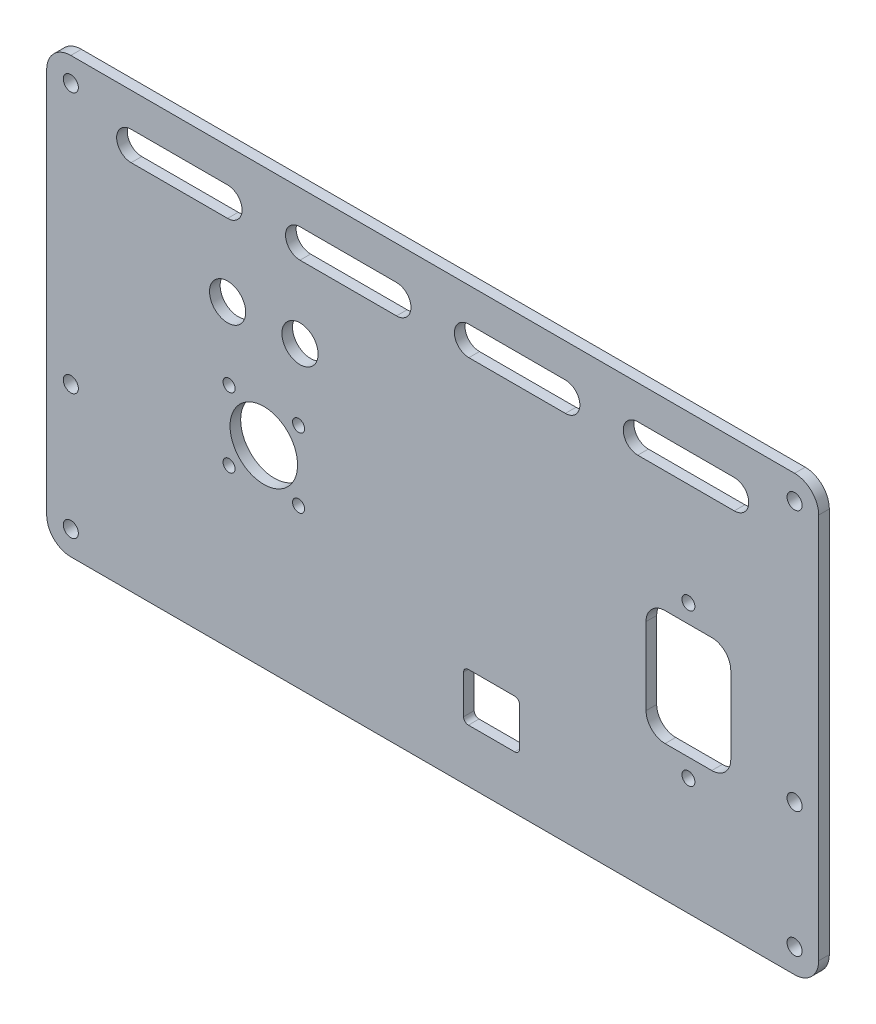
from build123d import *

# Parameters (mm, degrees)
SKETCH1_W                       = 203.2
SKETCH1_H                       = 114.3
BOSS_EXTRUDE1_DEPTH             = 2.794
F_5_32_0_15625_DIAMETER_HOLE1_D = 3.96875
FILLET2_R                       = 6.35
SKETCH7_R                       = 8.89
SKETCH7_R_2                     = 1.5875
SKETCH7_W                       = 14.732
SKETCH7_H                       = 12.7
CUT_EXTRUDE1_DEPTH              = 117.603983362
FILLET3_R                       = 1.27
F_3_8_0_375_DIAMETER_HOLE1_D    = 9.525
SKETCH12_R                      = 1.7
CUT_EXTRUDE4_DEPTH              = 117.603983362
CUT_EXTRUDE5_DEPTH              = 117.603983362


with BuildPart() as part:
    # Sketch1 → Boss-Extrude1 (new body)
    with BuildSketch(Plane.XY):
        Rectangle(SKETCH1_W, SKETCH1_H)
    extrude(amount=BOSS_EXTRUDE1_DEPTH)

    # 5/32 (0.15625) Diameter Hole1 (through all)
    with Locations(Plane.XY.offset(2.794)):
        with Locations((95.25, -17.78), (-95.25, 50.8), (95.25, 50.8), (95.25, -50.8), (-95.25, -50.8), (-95.25, -17.78)):
            Hole(F_5_32_0_15625_DIAMETER_HOLE1_D / 2)

    # Fillet2
    fillet2_edges = [part.edges().sort_by_distance(p)[0] for p in [
        (101.6, -57.15, 1.397),
        (-101.6, -57.15, 1.397),
        (-101.6, 57.15, 1.397),
        (101.6, 57.15, 1.397),
    ]]
    fillet(fillet2_edges, radius=FILLET2_R)

    # Sketch7 → Cut-Extrude1 (cut, through all)
    with BuildSketch(Plane(origin=(0, 0, 0), x_dir=(-1, 0, 0), z_dir=(0, 0, -1))):
        with Locations((44.45, -6.35)):
            Circle(SKETCH7_R)
        with Locations((53.6, 2.8)):
            Circle(SKETCH7_R_2)
        with Locations(Location((35.3, 2.8, 0), (0, 0, 180))):
            Circle(SKETCH7_R_2)
        with Locations(Location((53.6, -15.5, 0), (0, 0, 180))):
            Circle(SKETCH7_R_2)
        with Locations((35.3, -15.5)):
            Circle(SKETCH7_R_2)
        with Locations((-15.494, -36.83)):
            Rectangle(SKETCH7_W, SKETCH7_H)
    extrude(amount=-CUT_EXTRUDE1_DEPTH, mode=Mode.SUBTRACT)

    # Fillet3
    fillet3_edges = [part.edges().sort_by_distance(p)[0] for p in [
        (22.86, -43.18, 1.397),
        (22.86, -30.48, 1.397),
        (8.128, -30.48, 1.397),
        (8.128, -43.18, 1.397),
    ]]
    fillet(fillet3_edges, radius=FILLET3_R)

    # 3/8 (0.375) Diameter Hole1 (through all)
    with Locations(Plane(origin=(0, 0, 0), x_dir=(-1, 0, 0), z_dir=(0, 0, -1))):
        with Locations((53.975, 21.59), (34.925, 21.59)):
            Hole(F_3_8_0_375_DIAMETER_HOLE1_D / 2)

    # Sketch12 → Cut-Extrude4 (cut, through all)
    with BuildSketch(Plane(origin=(0, 0, 0), x_dir=(-1, 0, 0), z_dir=(0, 0, -1))):
        with Locations((-67.31, -26.35)):
            Circle(SKETCH12_R)
        with Locations(Location((-67.31, 13.65, 0), (0, 0, 180))):
            Circle(SKETCH12_R)
        with BuildLine():
            Line((-73.46, 8.8), (-61.16, 8.8))
            ThreePointArc((-61.16, 8.8), (-57.624466094, 7.335533906), (-56.16, 3.8))
            Line((-56.16, 3.8), (-56.16, -16.5))
            ThreePointArc((-56.16, -16.5), (-57.624466094, -20.035533906), (-61.16, -21.5))
            Line((-61.16, -21.5), (-73.46, -21.5))
            ThreePointArc((-73.46, -21.5), (-76.995533906, -20.035533906), (-78.46, -16.5))
            Line((-78.46, -16.5), (-78.46, 3.8))
            ThreePointArc((-78.46, 3.8), (-76.995533906, 7.335533906), (-73.46, 8.8))
        make_face()
    extrude(amount=-CUT_EXTRUDE4_DEPTH, mode=Mode.SUBTRACT)

    # Sketch13 → Cut-Extrude5 (cut, through all)
    with BuildSketch(Plane(origin=(0, 0, 0), x_dir=(-1, 0, 0), z_dir=(0, 0, -1))):
        with BuildLine():
            Line((-79.375, 48.26), (-53.975, 48.26))
            ThreePointArc((-53.975, 48.26), (-50.165, 44.45), (-53.975, 40.64))
            Line((-53.975, 40.64), (-79.375, 40.64))
            ThreePointArc((-79.375, 40.64), (-83.185, 44.45), (-79.375, 48.26))
        make_face()
        with BuildLine():
            Line((79.375, 48.26), (53.975, 48.26))
            ThreePointArc((53.975, 48.26), (50.165, 44.45), (53.975, 40.64))
            Line((53.975, 40.64), (79.375, 40.64))
            ThreePointArc((79.375, 40.64), (83.185, 44.45), (79.375, 48.26))
        make_face()
        with BuildLine():
            Line((-34.925, 48.26), (-9.525, 48.26))
            ThreePointArc((-9.525, 48.26), (-5.715, 44.45), (-9.525, 40.64))
            Line((-9.525, 40.64), (-34.925, 40.64))
            ThreePointArc((-34.925, 40.64), (-38.735, 44.45), (-34.925, 48.26))
        make_face()
        with BuildLine():
            Line((34.925, 48.26), (9.525, 48.26))
            ThreePointArc((9.525, 48.26), (5.715, 44.45), (9.525, 40.64))
            Line((9.525, 40.64), (34.925, 40.64))
            ThreePointArc((34.925, 40.64), (38.735, 44.45), (34.925, 48.26))
        make_face()
    extrude(amount=-CUT_EXTRUDE5_DEPTH, mode=Mode.SUBTRACT)


solid = part.part
